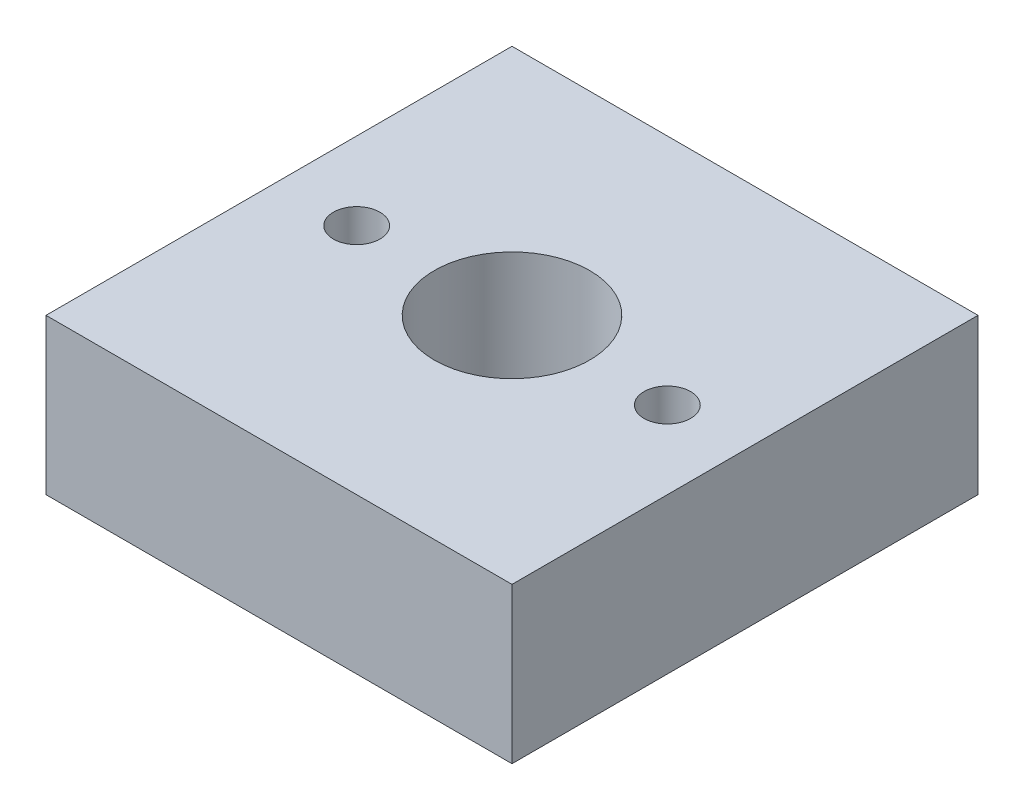
from build123d import *

# Parameters (mm, degrees)
SKETCH1_W             = 30
SKETCH1_H             = 30
BOSS_EXTRUDE1_DEPTH   = 10
SKETCH2_R             = 5
CUT_EXTRUDE1_DEPTH    = 44.588989435
F_3_0MM_DOWEL_HOLE1_D = 3


with BuildPart() as part:
    # Sketch1 → Boss-Extrude1 (new body)
    with BuildSketch(Plane(origin=(0, 0, 0), x_dir=(1, 0, 0), z_dir=(0, 1, 0))):
        with Locations((15, 15)):
            Rectangle(SKETCH1_W, SKETCH1_H)
    extrude(amount=BOSS_EXTRUDE1_DEPTH)

    # Sketch2 → Cut-Extrude1 (cut, through all)
    with BuildSketch(Plane(origin=(0, 10, 0), x_dir=(1, 0, 0), z_dir=(0, 1, 0))):
        with Locations(Location((15, 15, 0), (0, 0, 270))):
            Circle(SKETCH2_R)
    extrude(amount=-CUT_EXTRUDE1_DEPTH, mode=Mode.SUBTRACT)

    # Ø3.0mm Dowel Hole1 (through all)
    with Locations(Plane(origin=(0, 10, 0), x_dir=(1, 0, 0), z_dir=(0, 1, 0))):
        with Locations((5, 15), (25, 15)):
            Hole(F_3_0MM_DOWEL_HOLE1_D / 2)


solid = part.part
